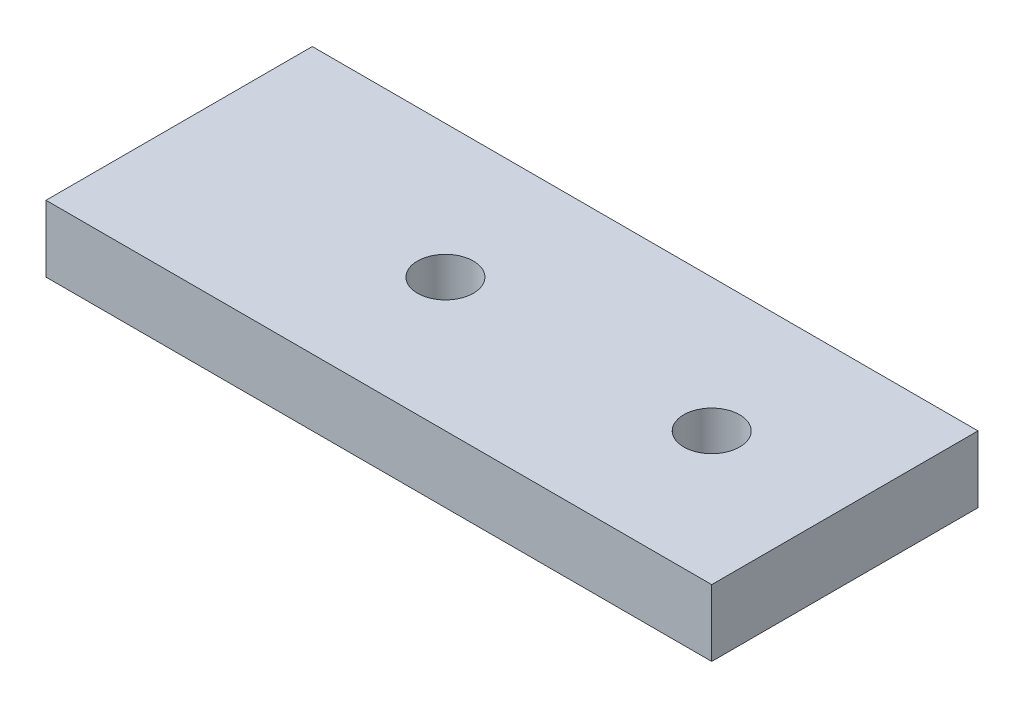
from build123d import *

# Parameters (mm, degrees)
SKETCH1_W           = 63.5
SKETCH1_H           = 25.4
BOSS_EXTRUDE1_DEPTH = 6.35
SKETCH2_R           = 2.667
CUT_EXTRUDE1_DEPTH  = 69.685751798


with BuildPart() as part:
    # Sketch1 → Boss-Extrude1 (new body)
    with BuildSketch(Plane(origin=(0, 0, 0), x_dir=(1, 0, 0), z_dir=(0, 1, 0))):
        with Locations((31.75, 12.7)):
            Rectangle(SKETCH1_W, SKETCH1_H)
    extrude(amount=BOSS_EXTRUDE1_DEPTH)

    # Sketch2 → Cut-Extrude1 (cut, through all)
    with BuildSketch(Plane(origin=(0, 6.35, 0), x_dir=(1, 0, 0), z_dir=(0, 1, 0))):
        with Locations(Location((25.4, 12.7, 0), (0, 0, 270))):
            Circle(SKETCH2_R)
        with Locations(Location((50.8, 12.7, 0), (0, 0, 270))):
            Circle(SKETCH2_R)
    extrude(amount=-CUT_EXTRUDE1_DEPTH, mode=Mode.SUBTRACT)


solid = part.part
